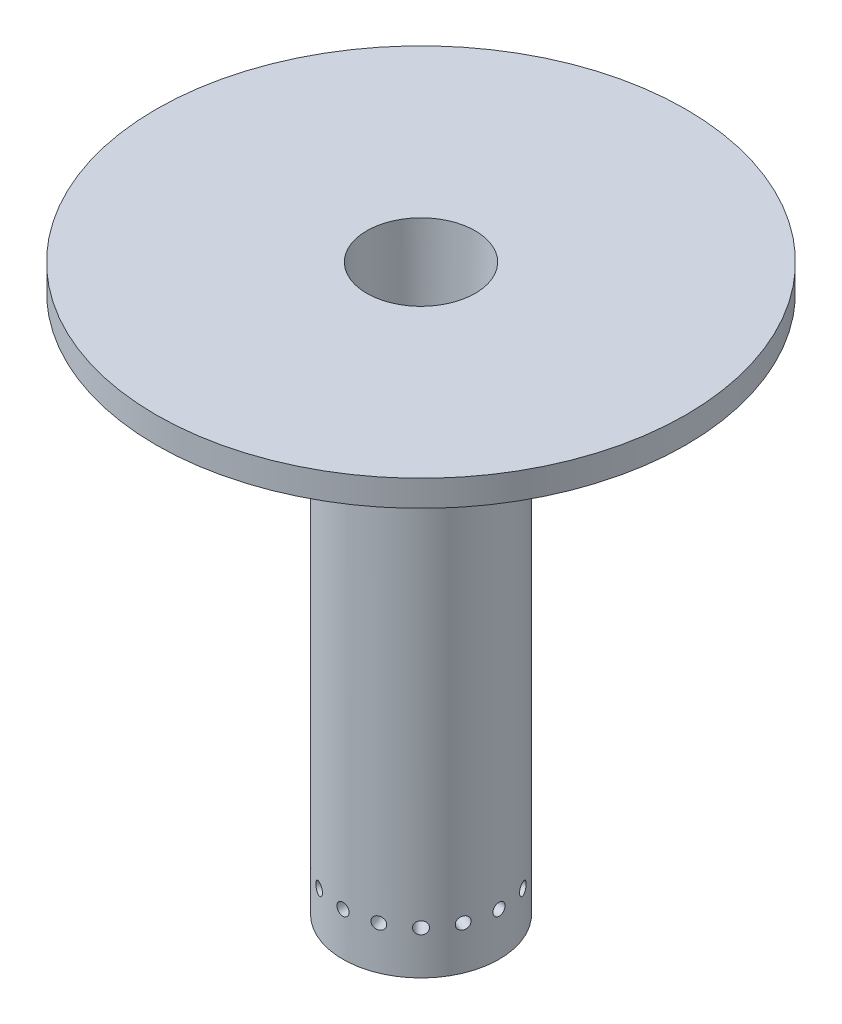
from build123d import *

# Parameters (mm, degrees)
F_3_8_0_375_DIAMETER_HOLE1_D     = 9.525
F_3_8_0_375_DIAMETER_HOLE1_DEPTH = 61
F_3_8_0_375_DIAMETER_HOLE1_TIP   = 2.861598698
F_54_0_055_DIAMETER_HOLE1_REACH  = 83.931
F_54_0_055_DIAMETER_HOLE1_BORE_R = 0.6985
CIRPATTERN1_COUNT                = 16


with BuildPart() as part:
    # Sketch1 → Revolve1 (revolve)
    with BuildSketch(Plane.XY, mode=Mode.PRIVATE) as revolve1_sk:
        Polygon((0, 0), (-30.48, 0), (-30.48, -3), (-17.78, -3), (-17.78, -8), (-9, -8), (-9, -65), (0, -65), align=None)
    revolve(revolve1_sk.sketch.rotate(Axis((0, -65, 0), (0, 1, 0)), 270), axis=Axis((0, -65, 0), (0, 1, 0)))

    # Sketch4 → 1/4 NPT Tapped Hole1 (revolve, cut)
    with BuildSketch(Plane(origin=(0, 0, 0), x_dir=(0, 0, 1), z_dir=(1, 0, 0))):
        Polygon((0, 0), (0, 40.412347279), (5.5626, 37.07), (5.5626, 10.02), (5.943676082, 10.02), (6.2436883, 0), align=None)
    revolve(axis=Axis((0, 6.35, 0), (0, -1, 0)), mode=Mode.SUBTRACT)

    # 3/8 (0.375) Diameter Hole1
    with Locations(Plane(origin=(0, 0, 0), x_dir=(1, 0, 0), z_dir=(0, 1, 0))):
        with Locations((0, 0)):
            Hole(F_3_8_0_375_DIAMETER_HOLE1_D / 2, depth=F_3_8_0_375_DIAMETER_HOLE1_DEPTH)
            with Locations((0, 0, -(F_3_8_0_375_DIAMETER_HOLE1_DEPTH + F_3_8_0_375_DIAMETER_HOLE1_TIP / 2))):  # 118° drill point
                Cone(0, F_3_8_0_375_DIAMETER_HOLE1_D / 2, F_3_8_0_375_DIAMETER_HOLE1_TIP, mode=Mode.SUBTRACT)

    # #54 (0.055) Diameter Hole1 bore → #54 (0.055) Diameter Hole1 (cut, up to next)
    with BuildSketch(Plane.XY.offset(9), mode=Mode.PRIVATE) as f_54_0_055_diameter_hole1_sk1:
        with Locations((0, -60)):
            Circle(F_54_0_055_DIAMETER_HOLE1_BORE_R)
    f_54_0_055_diameter_hole1_tool1 = extrude(f_54_0_055_diameter_hole1_sk1.sketch, amount=-F_54_0_055_DIAMETER_HOLE1_REACH, mode=Mode.PRIVATE) & part.part
    f_54_0_055_diameter_hole1 = f_54_0_055_diameter_hole1_tool1.solids().sort_by_distance((0, -60, 9))[0]
    add(f_54_0_055_diameter_hole1, mode=Mode.SUBTRACT)

    # CirPattern1: #54 (0.055) Diameter Hole1 ×16 about axis
    cirpattern1_axis = Axis((0, -65, 0), (0, -1, 0))
    for i in range(1, CIRPATTERN1_COUNT):
        add(f_54_0_055_diameter_hole1.rotate(cirpattern1_axis, i * 360 / CIRPATTERN1_COUNT), mode=Mode.SUBTRACT)


solid = part.part
